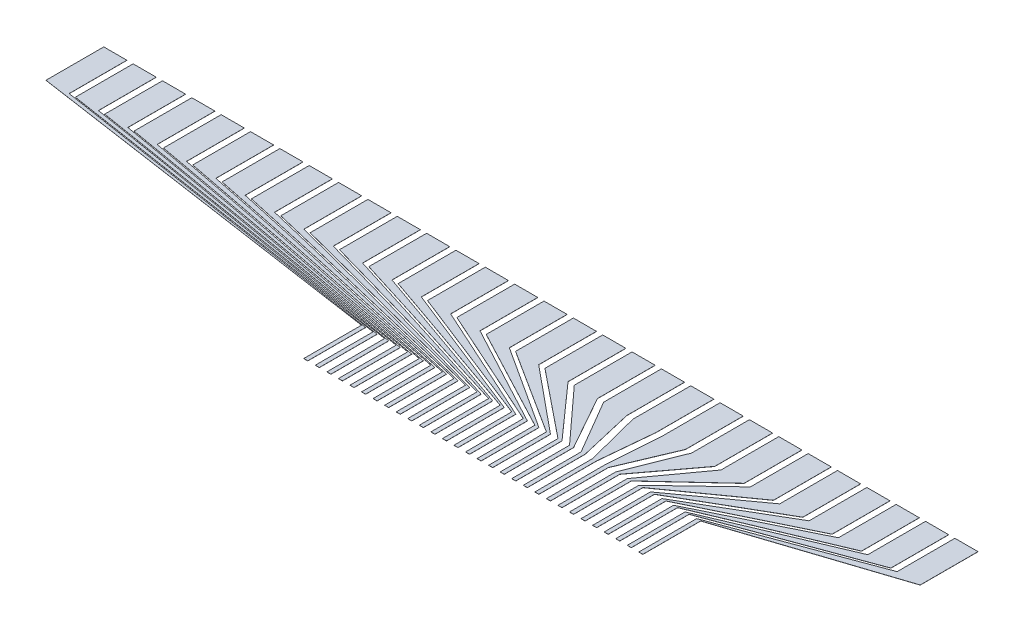
from build123d import *

# Parameters (mm, degrees)
EXTRUDE_1_DEPTH     = 0.01
EXTRUDE_1_2_DEPTH   = 0.01
EXTRUDE_1_3_DEPTH   = 0.01
EXTRUDE_1_4_DEPTH   = 0.01
EXTRUDE_1_5_DEPTH   = 0.01
EXTRUDE_1_6_DEPTH   = 0.01
EXTRUDE_1_7_DEPTH   = 0.01
EXTRUDE_1_8_DEPTH   = 0.01
EXTRUDE_1_9_DEPTH   = 0.01
EXTRUDE_1_10_DEPTH  = 0.01
EXTRUDE_1_11_DEPTH  = 0.01
EXTRUDE_1_12_DEPTH  = 0.01
EXTRUDE_1_13_DEPTH  = 0.01
EXTRUDE_1_14_DEPTH  = 0.01
EXTRUDE_1_15_DEPTH  = 0.01
EXTRUDE_1_16_DEPTH  = 0.01
EXTRUDE_1_17_DEPTH  = 0.01
EXTRUDE_1_18_DEPTH  = 0.01
EXTRUDE_1_19_DEPTH  = 0.01
EXTRUDE_1_20_DEPTH  = 0.01
EXTRUDE_1_21_DEPTH  = 0.01
EXTRUDE_1_22_DEPTH  = 0.01
EXTRUDE_1_23_DEPTH  = 0.01
EXTRUDE_1_24_DEPTH  = 0.01
EXTRUDE_1_25_DEPTH  = 0.01
EXTRUDE_1_26_DEPTH  = 0.01
EXTRUDE_1_27_DEPTH  = 0.01
EXTRUDE_1_28_DEPTH  = 0.01
EXTRUDE_1_29_DEPTH  = 0.01
EXTRUDE_1_30_DEPTH  = 0.01
SKETCH_2_W          = 29.347621289
SKETCH_2_H          = 1
CUT_EXTRUDE_1_DEPTH = 10


with BuildPart() as part:
    # 草图1 → 凸台-拉伸1 (new body)
    with BuildSketch(Plane(origin=(0, 0, 0), x_dir=(1, 0, 0), z_dir=(0, 1, 0))):
        Polygon((76.2, 0), (76.2, -5), (61.89758937, -9.7), (61.89758937, -15.7), (61.549968081, -15.7), (61.549968081, -9.7), (74.2, -5), (74.2, 0), align=None)
    extrude(amount=EXTRUDE_1_DEPTH)


with BuildPart() as body_2:
    # 草图1 → Extrude 1 2 (new body)
    with BuildSketch(Plane(origin=(0, 0, 0), x_dir=(1, 0, 0), z_dir=(0, 1, 0))):
        Polygon((71.66, 0), (73.66, 0), (73.66, -5), (60.89758937, -9.7), (60.89758937, -15.7), (60.549968081, -15.7), (60.549968081, -9.7), (71.66, -5), align=None)
    extrude(amount=EXTRUDE_1_2_DEPTH)


with BuildPart() as body_3:
    # 草图1 → Extrude 1 3 (new body)
    with BuildSketch(Plane(origin=(0, 0, 0), x_dir=(1, 0, 0), z_dir=(0, 1, 0))):
        Polygon((69.12, 0), (71.12, 0), (71.12, -5), (59.89758937, -9.7), (59.89758937, -15.7), (59.549968081, -15.7), (59.549968081, -9.7), (69.12, -5), align=None)
    extrude(amount=EXTRUDE_1_3_DEPTH)


with BuildPart() as body_4:
    # 草图1 → Extrude 1 4 (new body)
    with BuildSketch(Plane(origin=(0, 0, 0), x_dir=(1, 0, 0), z_dir=(0, 1, 0))):
        Polygon((66.58, 0), (68.58, 0), (68.58, -5), (58.89758937, -9.7), (58.89758937, -15.7), (58.549968081, -15.7), (58.549968081, -9.7), (66.58, -5), align=None)
    extrude(amount=EXTRUDE_1_4_DEPTH)


with BuildPart() as body_5:
    # 草图1 → Extrude 1 5 (new body)
    with BuildSketch(Plane(origin=(0, 0, 0), x_dir=(1, 0, 0), z_dir=(0, 1, 0))):
        Polygon((64.04, 0), (66.04, 0), (66.04, -5), (57.89758937, -9.7), (57.89758937, -15.7), (57.549968081, -15.7), (57.549968081, -9.7), (64.04, -5), align=None)
    extrude(amount=EXTRUDE_1_5_DEPTH)


with BuildPart() as body_6:
    # 草图1 → Extrude 1 6 (new body)
    with BuildSketch(Plane(origin=(0, 0, 0), x_dir=(1, 0, 0), z_dir=(0, 1, 0))):
        Polygon((61.5, 0), (63.5, 0), (63.5, -5), (56.89758937, -9.7), (56.89758937, -15.7), (56.549968081, -15.7), (56.549968081, -9.7), (61.5, -5), align=None)
    extrude(amount=EXTRUDE_1_6_DEPTH)


with BuildPart() as body_7:
    # 草图1 → Extrude 1 7 (new body)
    with BuildSketch(Plane(origin=(0, 0, 0), x_dir=(1, 0, 0), z_dir=(0, 1, 0))):
        Polygon((58.96, 0), (60.96, 0), (60.96, -5), (55.89758937, -9.7), (55.89758937, -15.7), (55.549968081, -15.7), (55.549968081, -9.7), (58.96, -5), align=None)
    extrude(amount=EXTRUDE_1_7_DEPTH)


with BuildPart() as body_8:
    # 草图1 → Extrude 1 8 (new body)
    with BuildSketch(Plane(origin=(0, 0, 0), x_dir=(1, 0, 0), z_dir=(0, 1, 0))):
        Polygon((56.42, 0), (58.42, 0), (58.42, -5), (54.89758937, -9.7), (54.89758937, -15.7), (54.549968081, -15.7), (54.549968081, -9.7), (56.42, -5), align=None)
    extrude(amount=EXTRUDE_1_8_DEPTH)


with BuildPart() as body_9:
    # 草图1 → Extrude 1 9 (new body)
    with BuildSketch(Plane(origin=(0, 0, 0), x_dir=(1, 0, 0), z_dir=(0, 1, 0))):
        Polygon((53.88, 0), (55.88, 0), (55.88, -5), (53.89758937, -9.7), (53.89758937, -15.7), (53.549968081, -15.7), (53.549968081, -9.7), (53.88, -5), align=None)
    extrude(amount=EXTRUDE_1_9_DEPTH)


with BuildPart() as body_10:
    # 草图1 → Extrude 1 10 (new body)
    with BuildSketch(Plane(origin=(0, 0, 0), x_dir=(1, 0, 0), z_dir=(0, 1, 0))):
        Polygon((51.34, 0), (53.34, 0), (53.34, -5), (52.89758937, -9.7), (52.89758937, -15.7), (52.549968081, -15.7), (52.549968081, -9.7), (51.34, -5), align=None)
    extrude(amount=EXTRUDE_1_10_DEPTH)


with BuildPart() as body_11:
    # 草图1 → Extrude 1 11 (new body)
    with BuildSketch(Plane(origin=(0, 0, 0), x_dir=(1, 0, 0), z_dir=(0, 1, 0))):
        Polygon((48.8, 0), (50.8, 0), (50.8, -5), (51.89758937, -9.7), (51.89758937, -15.7), (51.549968081, -15.7), (51.549968081, -9.7), (48.8, -5), align=None)
    extrude(amount=EXTRUDE_1_11_DEPTH)


with BuildPart() as body_12:
    # 草图1 → Extrude 1 12 (new body)
    with BuildSketch(Plane(origin=(0, 0, 0), x_dir=(1, 0, 0), z_dir=(0, 1, 0))):
        Polygon((46.26, 0), (48.26, 0), (48.26, -5), (50.89758937, -9.7), (50.89758937, -15.7), (50.549968081, -15.7), (50.549968081, -9.7), (46.26, -5), align=None)
    extrude(amount=EXTRUDE_1_12_DEPTH)


with BuildPart() as body_13:
    # 草图1 → Extrude 1 13 (new body)
    with BuildSketch(Plane(origin=(0, 0, 0), x_dir=(1, 0, 0), z_dir=(0, 1, 0))):
        Polygon((43.72, 0), (45.72, 0), (45.72, -5), (49.89758937, -9.7), (49.89758937, -15.7), (49.549968081, -15.7), (49.549968081, -9.7), (43.72, -5), align=None)
    extrude(amount=EXTRUDE_1_13_DEPTH)


with BuildPart() as body_14:
    # 草图1 → Extrude 1 14 (new body)
    with BuildSketch(Plane(origin=(0, 0, 0), x_dir=(1, 0, 0), z_dir=(0, 1, 0))):
        Polygon((41.18, 0), (43.18, 0), (43.18, -5), (48.89758937, -9.7), (48.89758937, -15.7), (48.549968081, -15.7), (48.549968081, -9.7), (41.18, -5), align=None)
    extrude(amount=EXTRUDE_1_14_DEPTH)


with BuildPart() as body_15:
    # 草图1 → Extrude 1 15 (new body)
    with BuildSketch(Plane(origin=(0, 0, 0), x_dir=(1, 0, 0), z_dir=(0, 1, 0))):
        Polygon((38.64, 0), (40.64, 0), (40.64, -5), (47.89758937, -9.7), (47.89758937, -15.7), (47.549968081, -15.7), (47.549968081, -9.7), (38.64, -5), align=None)
    extrude(amount=EXTRUDE_1_15_DEPTH)


with BuildPart() as body_16:
    # 草图1 → Extrude 1 16 (new body)
    with BuildSketch(Plane(origin=(0, 0, 0), x_dir=(1, 0, 0), z_dir=(0, 1, 0))):
        Polygon((36.1, 0), (38.1, 0), (38.1, -5), (46.89758937, -9.7), (46.89758937, -15.7), (46.549968081, -15.7), (46.549968081, -9.7), (36.1, -5), align=None)
    extrude(amount=EXTRUDE_1_16_DEPTH)


with BuildPart() as body_17:
    # 草图1 → Extrude 1 17 (new body)
    with BuildSketch(Plane(origin=(0, 0, 0), x_dir=(1, 0, 0), z_dir=(0, 1, 0))):
        Polygon((33.56, 0), (35.56, 0), (35.56, -5), (45.89758937, -9.7), (45.89758937, -15.7), (45.549968081, -15.7), (45.549968081, -9.7), (33.56, -5), align=None)
    extrude(amount=EXTRUDE_1_17_DEPTH)


with BuildPart() as body_18:
    # 草图1 → Extrude 1 18 (new body)
    with BuildSketch(Plane(origin=(0, 0, 0), x_dir=(1, 0, 0), z_dir=(0, 1, 0))):
        Polygon((31.02, 0), (33.02, 0), (33.02, -5), (44.89758937, -9.7), (44.89758937, -15.7), (44.549968081, -15.7), (44.549968081, -9.7), (31.02, -5), align=None)
    extrude(amount=EXTRUDE_1_18_DEPTH)


with BuildPart() as body_19:
    # 草图1 → Extrude 1 19 (new body)
    with BuildSketch(Plane(origin=(0, 0, 0), x_dir=(1, 0, 0), z_dir=(0, 1, 0))):
        Polygon((28.48, 0), (30.48, 0), (30.48, -5), (43.89758937, -9.7), (43.89758937, -15.7), (43.549968081, -15.7), (43.549968081, -9.7), (28.48, -5), align=None)
    extrude(amount=EXTRUDE_1_19_DEPTH)


with BuildPart() as body_20:
    # 草图1 → Extrude 1 20 (new body)
    with BuildSketch(Plane(origin=(0, 0, 0), x_dir=(1, 0, 0), z_dir=(0, 1, 0))):
        Polygon((25.94, 0), (27.94, 0), (27.94, -5), (42.89758937, -9.7), (42.89758937, -15.7), (42.549968081, -15.7), (42.549968081, -9.7), (25.94, -5), align=None)
    extrude(amount=EXTRUDE_1_20_DEPTH)


with BuildPart() as body_21:
    # 草图1 → Extrude 1 21 (new body)
    with BuildSketch(Plane(origin=(0, 0, 0), x_dir=(1, 0, 0), z_dir=(0, 1, 0))):
        Polygon((23.4, 0), (25.4, 0), (25.4, -5), (41.89758937, -9.7), (41.89758937, -15.7), (41.549968081, -15.7), (41.549968081, -9.7), (23.4, -5), align=None)
    extrude(amount=EXTRUDE_1_21_DEPTH)


with BuildPart() as body_22:
    # 草图1 → Extrude 1 22 (new body)
    with BuildSketch(Plane(origin=(0, 0, 0), x_dir=(1, 0, 0), z_dir=(0, 1, 0))):
        Polygon((20.86, 0), (22.86, 0), (22.86, -5), (40.89758937, -9.7), (40.89758937, -15.7), (40.549968081, -15.7), (40.549968081, -9.7), (20.86, -5), align=None)
    extrude(amount=EXTRUDE_1_22_DEPTH)


with BuildPart() as body_23:
    # 草图1 → Extrude 1 23 (new body)
    with BuildSketch(Plane(origin=(0, 0, 0), x_dir=(1, 0, 0), z_dir=(0, 1, 0))):
        Polygon((18.32, 0), (20.32, 0), (20.32, -5), (39.89758937, -9.7), (39.89758937, -15.7), (39.549968081, -15.7), (39.549968081, -9.7), (18.32, -5), align=None)
    extrude(amount=EXTRUDE_1_23_DEPTH)


with BuildPart() as body_24:
    # 草图1 → Extrude 1 24 (new body)
    with BuildSketch(Plane(origin=(0, 0, 0), x_dir=(1, 0, 0), z_dir=(0, 1, 0))):
        Polygon((15.78, 0), (17.78, 0), (17.78, -5), (38.89758937, -9.7), (38.89758937, -15.7), (38.549968081, -15.7), (38.549968081, -9.7), (15.78, -5), align=None)
    extrude(amount=EXTRUDE_1_24_DEPTH)


with BuildPart() as body_25:
    # 草图1 → Extrude 1 25 (new body)
    with BuildSketch(Plane(origin=(0, 0, 0), x_dir=(1, 0, 0), z_dir=(0, 1, 0))):
        Polygon((13.24, 0), (15.24, 0), (15.24, -5), (37.89758937, -9.7), (37.89758937, -15.7), (37.549968081, -15.7), (37.549968081, -9.7), (13.24, -5), align=None)
    extrude(amount=EXTRUDE_1_25_DEPTH)


with BuildPart() as body_26:
    # 草图1 → Extrude 1 26 (new body)
    with BuildSketch(Plane(origin=(0, 0, 0), x_dir=(1, 0, 0), z_dir=(0, 1, 0))):
        Polygon((10.7, 0), (12.7, 0), (12.7, -5), (36.89758937, -9.7), (36.89758937, -15.7), (36.549968081, -15.7), (36.549968081, -9.7), (10.7, -5), align=None)
    extrude(amount=EXTRUDE_1_26_DEPTH)


with BuildPart() as body_27:
    # 草图1 → Extrude 1 27 (new body)
    with BuildSketch(Plane(origin=(0, 0, 0), x_dir=(1, 0, 0), z_dir=(0, 1, 0))):
        Polygon((8.16, 0), (10.16, 0), (10.16, -5), (35.89758937, -9.7), (35.89758937, -15.7), (35.549968081, -15.7), (35.549968081, -9.7), (8.16, -5), align=None)
    extrude(amount=EXTRUDE_1_27_DEPTH)


with BuildPart() as body_28:
    # 草图1 → Extrude 1 28 (new body)
    with BuildSketch(Plane(origin=(0, 0, 0), x_dir=(1, 0, 0), z_dir=(0, 1, 0))):
        Polygon((5.62, 0), (7.62, 0), (7.62, -5), (34.89758937, -9.7), (34.89758937, -15.7), (34.549968081, -15.7), (34.549968081, -9.7), (5.62, -5), align=None)
    extrude(amount=EXTRUDE_1_28_DEPTH)


with BuildPart() as body_29:
    # 草图1 → Extrude 1 29 (new body)
    with BuildSketch(Plane(origin=(0, 0, 0), x_dir=(1, 0, 0), z_dir=(0, 1, 0))):
        Polygon((3.08, 0), (5.08, 0), (5.08, -5), (33.89758937, -9.7), (33.89758937, -15.7), (33.549968081, -15.7), (33.549968081, -9.7), (3.08, -5), align=None)
    extrude(amount=EXTRUDE_1_29_DEPTH)


with BuildPart() as body_30:
    # 草图1 → Extrude 1 30 (new body)
    with BuildSketch(Plane(origin=(0, 0, 0), x_dir=(1, 0, 0), z_dir=(0, 1, 0))):
        Polygon((0.54, 0), (2.54, 0), (2.54, -5), (32.89758937, -9.7), (32.89758937, -15.7), (32.549968081, -15.7), (32.549968081, -9.7), (0.54, -5), align=None)
    extrude(amount=EXTRUDE_1_30_DEPTH)


with BuildPart() as cut_extrude_1_tool:
    # 草图2 → 切除-拉伸1 (new body)
    with BuildSketch(Plane(origin=(0, 0.01, 0), x_dir=(1, 0, 0), z_dir=(0, 1, 0))):
        with Locations((47.223778726, -15.2)):
            Rectangle(SKETCH_2_W, SKETCH_2_H)
    extrude(amount=-CUT_EXTRUDE_1_DEPTH)


with BuildPart() as part_1:
    add(part.part)

    # 切除-拉伸1: cut by cut_extrude_1_tool
    add(cut_extrude_1_tool.part, mode=Mode.SUBTRACT)


with BuildPart() as body_2_1:
    add(body_2.part)

    # 切除-拉伸1: cut by cut_extrude_1_tool
    add(cut_extrude_1_tool.part, mode=Mode.SUBTRACT)


with BuildPart() as body_3_1:
    add(body_3.part)

    # 切除-拉伸1: cut by cut_extrude_1_tool
    add(cut_extrude_1_tool.part, mode=Mode.SUBTRACT)


with BuildPart() as body_4_1:
    add(body_4.part)

    # 切除-拉伸1: cut by cut_extrude_1_tool
    add(cut_extrude_1_tool.part, mode=Mode.SUBTRACT)


with BuildPart() as body_5_1:
    add(body_5.part)

    # 切除-拉伸1: cut by cut_extrude_1_tool
    add(cut_extrude_1_tool.part, mode=Mode.SUBTRACT)


with BuildPart() as body_6_1:
    add(body_6.part)

    # 切除-拉伸1: cut by cut_extrude_1_tool
    add(cut_extrude_1_tool.part, mode=Mode.SUBTRACT)


with BuildPart() as body_7_1:
    add(body_7.part)

    # 切除-拉伸1: cut by cut_extrude_1_tool
    add(cut_extrude_1_tool.part, mode=Mode.SUBTRACT)


with BuildPart() as body_8_1:
    add(body_8.part)

    # 切除-拉伸1: cut by cut_extrude_1_tool
    add(cut_extrude_1_tool.part, mode=Mode.SUBTRACT)


with BuildPart() as body_9_1:
    add(body_9.part)

    # 切除-拉伸1: cut by cut_extrude_1_tool
    add(cut_extrude_1_tool.part, mode=Mode.SUBTRACT)


with BuildPart() as body_10_1:
    add(body_10.part)

    # 切除-拉伸1: cut by cut_extrude_1_tool
    add(cut_extrude_1_tool.part, mode=Mode.SUBTRACT)


with BuildPart() as body_11_1:
    add(body_11.part)

    # 切除-拉伸1: cut by cut_extrude_1_tool
    add(cut_extrude_1_tool.part, mode=Mode.SUBTRACT)


with BuildPart() as body_12_1:
    add(body_12.part)

    # 切除-拉伸1: cut by cut_extrude_1_tool
    add(cut_extrude_1_tool.part, mode=Mode.SUBTRACT)


with BuildPart() as body_13_1:
    add(body_13.part)

    # 切除-拉伸1: cut by cut_extrude_1_tool
    add(cut_extrude_1_tool.part, mode=Mode.SUBTRACT)


with BuildPart() as body_14_1:
    add(body_14.part)

    # 切除-拉伸1: cut by cut_extrude_1_tool
    add(cut_extrude_1_tool.part, mode=Mode.SUBTRACT)


with BuildPart() as body_15_1:
    add(body_15.part)

    # 切除-拉伸1: cut by cut_extrude_1_tool
    add(cut_extrude_1_tool.part, mode=Mode.SUBTRACT)


with BuildPart() as body_16_1:
    add(body_16.part)

    # 切除-拉伸1: cut by cut_extrude_1_tool
    add(cut_extrude_1_tool.part, mode=Mode.SUBTRACT)


with BuildPart() as body_17_1:
    add(body_17.part)

    # 切除-拉伸1: cut by cut_extrude_1_tool
    add(cut_extrude_1_tool.part, mode=Mode.SUBTRACT)


with BuildPart() as body_18_1:
    add(body_18.part)

    # 切除-拉伸1: cut by cut_extrude_1_tool
    add(cut_extrude_1_tool.part, mode=Mode.SUBTRACT)


with BuildPart() as body_19_1:
    add(body_19.part)

    # 切除-拉伸1: cut by cut_extrude_1_tool
    add(cut_extrude_1_tool.part, mode=Mode.SUBTRACT)


with BuildPart() as body_20_1:
    add(body_20.part)

    # 切除-拉伸1: cut by cut_extrude_1_tool
    add(cut_extrude_1_tool.part, mode=Mode.SUBTRACT)


with BuildPart() as body_21_1:
    add(body_21.part)

    # 切除-拉伸1: cut by cut_extrude_1_tool
    add(cut_extrude_1_tool.part, mode=Mode.SUBTRACT)


with BuildPart() as body_22_1:
    add(body_22.part)

    # 切除-拉伸1: cut by cut_extrude_1_tool
    add(cut_extrude_1_tool.part, mode=Mode.SUBTRACT)


with BuildPart() as body_23_1:
    add(body_23.part)

    # 切除-拉伸1: cut by cut_extrude_1_tool
    add(cut_extrude_1_tool.part, mode=Mode.SUBTRACT)


with BuildPart() as body_24_1:
    add(body_24.part)

    # 切除-拉伸1: cut by cut_extrude_1_tool
    add(cut_extrude_1_tool.part, mode=Mode.SUBTRACT)


with BuildPart() as body_25_1:
    add(body_25.part)

    # 切除-拉伸1: cut by cut_extrude_1_tool
    add(cut_extrude_1_tool.part, mode=Mode.SUBTRACT)


with BuildPart() as body_26_1:
    add(body_26.part)

    # 切除-拉伸1: cut by cut_extrude_1_tool
    add(cut_extrude_1_tool.part, mode=Mode.SUBTRACT)


with BuildPart() as body_27_1:
    add(body_27.part)

    # 切除-拉伸1: cut by cut_extrude_1_tool
    add(cut_extrude_1_tool.part, mode=Mode.SUBTRACT)


with BuildPart() as body_28_1:
    add(body_28.part)

    # 切除-拉伸1: cut by cut_extrude_1_tool
    add(cut_extrude_1_tool.part, mode=Mode.SUBTRACT)


with BuildPart() as body_29_1:
    add(body_29.part)

    # 切除-拉伸1: cut by cut_extrude_1_tool
    add(cut_extrude_1_tool.part, mode=Mode.SUBTRACT)


with BuildPart() as body_30_1:
    add(body_30.part)

    # 切除-拉伸1: cut by cut_extrude_1_tool
    add(cut_extrude_1_tool.part, mode=Mode.SUBTRACT)


solid = Compound([part_1.part, body_2_1.part, body_3_1.part, body_4_1.part, body_5_1.part, body_6_1.part, body_7_1.part, body_8_1.part, body_9_1.part, body_10_1.part, body_11_1.part, body_12_1.part, body_13_1.part, body_14_1.part, body_15_1.part, body_16_1.part, body_17_1.part, body_18_1.part, body_19_1.part, body_20_1.part, body_21_1.part, body_22_1.part, body_23_1.part, body_24_1.part, body_25_1.part, body_26_1.part, body_27_1.part, body_28_1.part, body_29_1.part, body_30_1.part])
